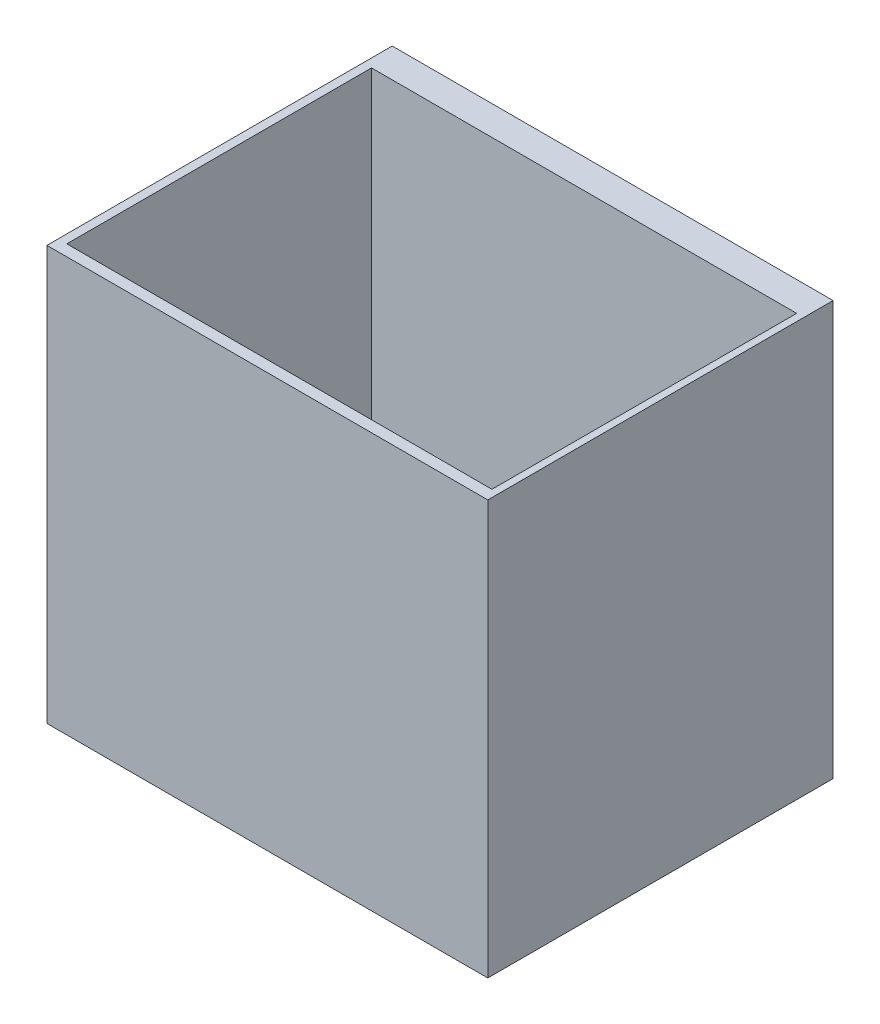
from build123d import *

# Parameters (mm, degrees)
BOSS_EXTRUDE1_START = 710
SKETCH2_W           = 616.707969139
SKETCH2_H           = 579.165034538
BOSS_EXTRUDE1_DEPTH = 483
SKETCH3_W           = 594.672235047
SKETCH3_H           = 426.228299924
CUT_EXTRUDE1_DEPTH  = 568
CUT_EXTRUDE2_START  = -100
CUT_EXTRUDE2_DEPTH  = 23


with BuildPart() as part:
    # Sketch2 → Boss-Extrude1 (new body)
    with BuildSketch(Plane.XY.offset(943.510776168).offset(BOSS_EXTRUDE1_START)):
        with Locations((826.513525673, 479.417482731)):
            Rectangle(SKETCH2_W, SKETCH2_H)
    extrude(amount=BOSS_EXTRUDE1_DEPTH)

    # Sketch3 → Cut-Extrude1 (cut)
    with BuildSketch(Plane(origin=(0, 769, 0), x_dir=(1, 0, 0), z_dir=(0, 1, 0))):
        with Locations((827.567040516, -1907.628066077)):
            Rectangle(SKETCH3_W, SKETCH3_H)
    extrude(amount=-CUT_EXTRUDE1_DEPTH, mode=Mode.SUBTRACT)

    # Sketch4 → Cut-Extrude2 (cut)
    with BuildSketch(Plane(origin=(0, 769, 0), x_dir=(1, 0, 0), z_dir=(0, 1, 0)).offset(CUT_EXTRUDE2_START)):
        with BuildLine():
            Line((826.513525672, -1680.127363582), (826.513525672, -1653.510776168))
            Line((826.513525672, -1653.510776168), (882.617138286, -1653.510776168))
            ThreePointArc((882.617138286, -1653.510776168), (858.584109748, -1675.290026262), (826.513525672, -1680.127363582))
        make_face()
    extrude(amount=-CUT_EXTRUDE2_DEPTH, mode=Mode.SUBTRACT)


solid = part.part
